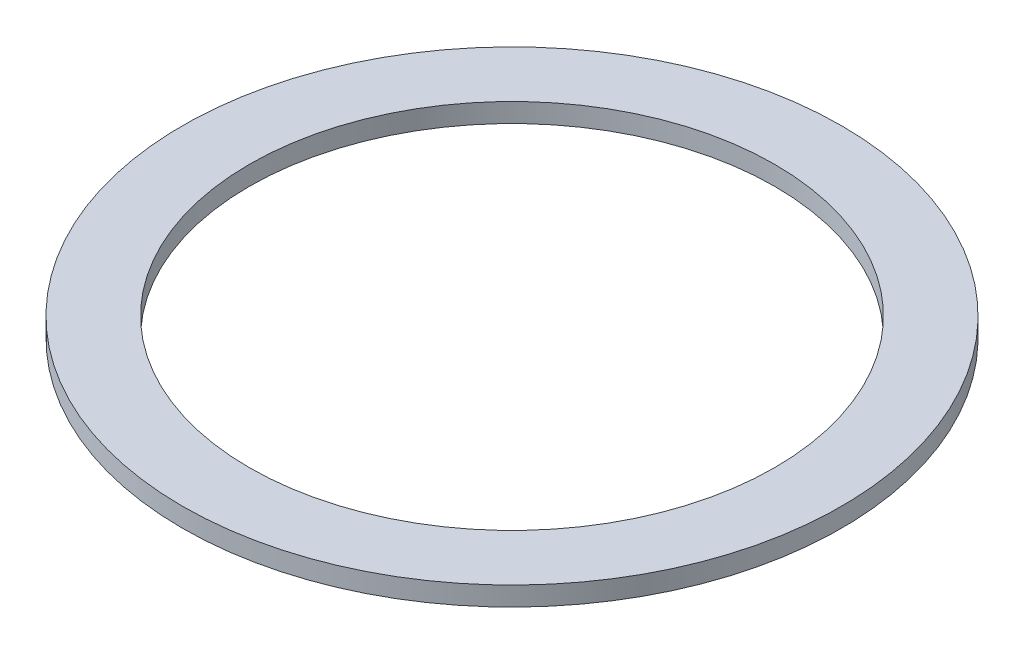
from build123d import *

# Parameters (mm, degrees)
CROQUIS1_R              = 34.5
CROQUIS1_R_2            = 27.5
SALIENTE_EXTRUIR1_DEPTH = 2


with BuildPart() as part:
    # Croquis1 → Saliente-Extruir1 (new body)
    with BuildSketch(Plane(origin=(0, 0, 0), x_dir=(1, 0, 0), z_dir=(0, 1, 0))):
        with Locations(Location((0, 0, 0), (0, 0, 270))):
            Circle(CROQUIS1_R)
        with Locations(Location((0, 0, 0), (0, 0, 270))):
            Circle(CROQUIS1_R_2, mode=Mode.SUBTRACT)
    extrude(amount=SALIENTE_EXTRUIR1_DEPTH)


solid = part.part
